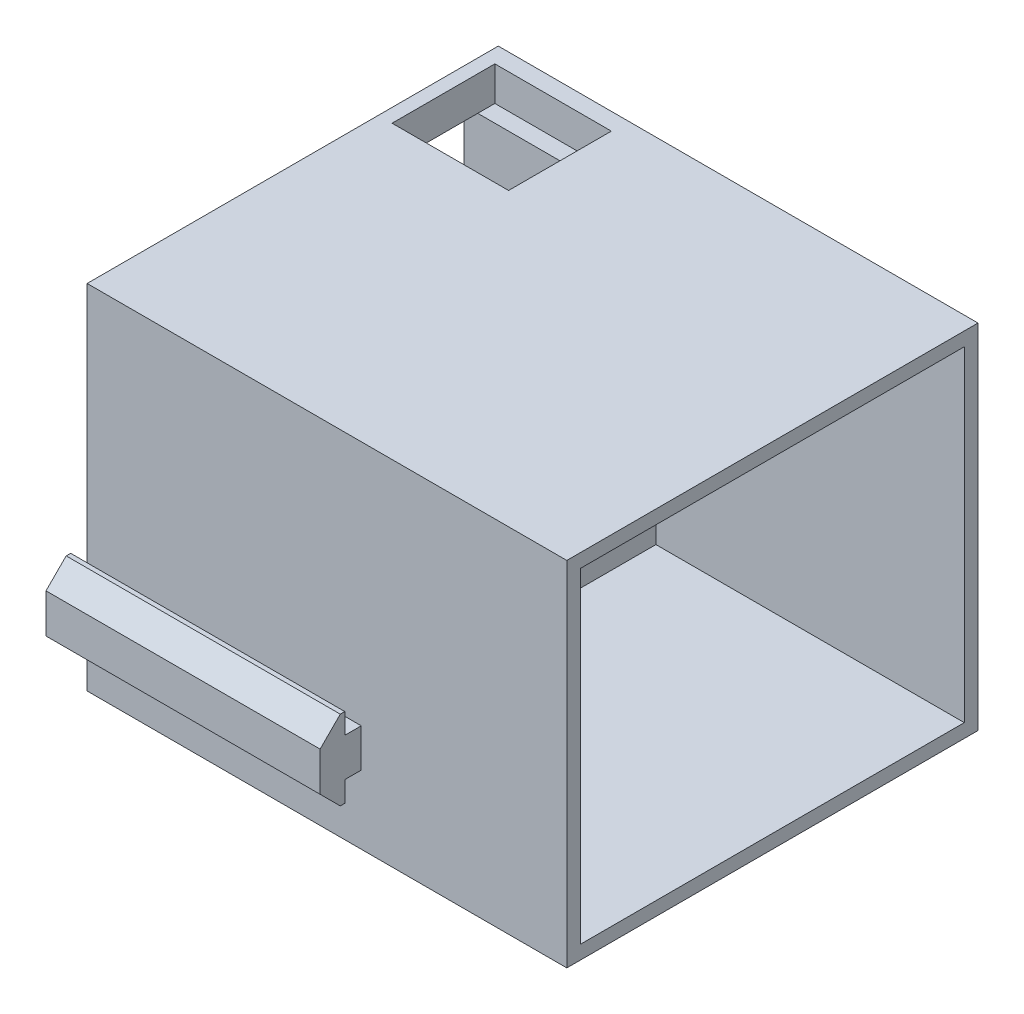
from build123d import *

# Parameters (mm, degrees)
SKETCH1_R            = 2.1
BOSS_EXTRUDE1_DEPTH  = 65
SKETCH84_W           = 0.2
SKETCH84_H           = 5.6
BOSS_EXTRUDE8_DEPTH  = 40
SKETCH86_W           = 21.745720746
SKETCH86_H           = 21.517119214
CUT_EXTRUDE59_DEPTH  = 67.55103305
SKETCH87_W           = 20
SKETCH87_H           = 51.5
SKETCH87_W_2         = 10
SKETCH87_H_2         = 41.5
BOSS_EXTRUDE9_DEPTH  = 70
SKETCH88_W           = 17
SKETCH88_H           = 15
CUT_EXTRUDE60_DEPTH  = 5
SKETCH89_W           = 20
SKETCH89_H           = 51.5
BOSS_EXTRUDE10_DEPTH = 50
SKETCH90_W           = 10
SKETCH90_H           = 41.5
BOSS_EXTRUDE11_DEPTH = 5
SKETCH91_W           = 16
SKETCH91_H           = 47.5
CUT_EXTRUDE61_DEPTH  = 30
SKETCH92_W           = 70
SKETCH92_H           = 51.5
BOSS_EXTRUDE12_DEPTH = 40
BOSS_EXTRUDE13_DEPTH = 40
SKETCH94_W           = 13.084115127
SKETCH94_H           = 30.286066168
CUT_EXTRUDE62_DEPTH  = 40
SKETCH95_W           = 56
SKETCH95_H           = 47.5
CUT_EXTRUDE63_DEPTH  = 45
SKETCH97_W           = 37
SKETCH97_H           = 45.5
CUT_EXTRUDE64_DEPTH  = 45
SKETCH98_W           = 38
SKETCH98_H           = 47.5
CUT_EXTRUDE65_DEPTH  = 45


with BuildPart() as part:
    # Sketch1 → Boss-Extrude1 (new body)
    with BuildSketch(Plane(origin=(0, 0, 0), x_dir=(0, 0, -1), z_dir=(1, 0, 0))):
        with BuildLine():
            Line((-10, 9), (-10, 3))
            Line((-10, 3), (-8, 3))
            Line((-8, 3), (-8, 6))
            Line((-8, 6), (-7.060660172, 6))
            Line((-7.060660172, 6), (-4, 2.939339828))
            Line((-4, 2.939339828), (-4, -2.939339828))
            Line((-4, -2.939339828), (-7.060660172, -6))
            Line((-7.060660172, -6), (-8, -6))
            Line((-8, -6), (-8, -3))
            Line((-8, -3), (-10, -3))
            Line((-10, -3), (-10, -9))
            ThreePointArc((-10, -9), (-9.707106781, -9.707106781), (-9, -10))
            Line((-9, -10), (-3, -10))
            Line((-3, -10), (-3, -8))
            Line((-3, -8), (-6, -8))
            Line((-6, -8), (-6, -7.060660172))
            Line((-6, -7.060660172), (-2.939339828, -4))
            Line((-2.939339828, -4), (2.939339828, -4))
            Line((2.939339828, -4), (6, -7.060660172))
            Line((6, -7.060660172), (6, -8))
            Line((6, -8), (3, -8))
            Line((3, -8), (3, -10))
            Line((3, -10), (9, -10))
            ThreePointArc((9, -10), (9.707106781, -9.707106781), (10, -9))
            Line((10, -9), (10, -3))
            Line((10, -3), (8, -3))
            Line((8, -3), (8, -6))
            Line((8, -6), (7.060660172, -6))
            Line((7.060660172, -6), (4, -2.939339828))
            Line((4, -2.939339828), (4, 2.939339828))
            Line((4, 2.939339828), (7.060660172, 6))
            Line((7.060660172, 6), (8, 6))
            Line((8, 6), (8, 3))
            Line((8, 3), (10, 3))
            Line((10, 3), (10, 9))
            ThreePointArc((10, 9), (9.707106781, 9.707106781), (9, 10))
            Line((9, 10), (3, 10))
            Line((3, 10), (3, 8))
            Line((3, 8), (6, 8))
            Line((6, 8), (6, 7.060660172))
            Line((6, 7.060660172), (2.939339828, 4))
            Line((2.939339828, 4), (-2.939339828, 4))
            Line((-2.939339828, 4), (-6, 7.060660172))
            Line((-6, 7.060660172), (-6, 8))
            Line((-6, 8), (-3, 8))
            Line((-3, 8), (-3, 10))
            Line((-3, 10), (-9, 10))
            ThreePointArc((-9, 10), (-9.707106781, 9.707106781), (-10, 9))
        make_face()
        Circle(SKETCH1_R, mode=Mode.SUBTRACT)
    extrude(amount=BOSS_EXTRUDE1_DEPTH)

    # Sketch86 → Cut-Extrude59 (cut, through all)
    with BuildSketch(Plane(origin=(65, 0, 0), x_dir=(0, 0, -1), z_dir=(1, 0, 0))):
        with Locations((0.085738745, -0.242889128)):
            Rectangle(SKETCH86_W, SKETCH86_H)
    extrude(amount=-CUT_EXTRUDE59_DEPTH, mode=Mode.SUBTRACT)


with BuildPart() as body_2:
    # Sketch84 → Boss-Extrude8 (new body)
    with BuildSketch(Plane(origin=(65, 0, 0), x_dir=(0, 0, -1), z_dir=(1, 0, 0))):
        with Locations((-10.1, 0)):
            Rectangle(SKETCH84_W, SKETCH84_H)
        with Locations((-9.9, 0)):
            Rectangle(SKETCH84_W, SKETCH84_H)
        Polygon((-7.8, 5.8), (-7.143502884, 5.8), (-4.2, 2.856497116), (-4.2, -2.856497116), (-7.143502884, -5.8), (-7.8, -5.8), (-7.8, -2.8), (-9.8, -2.8), (-9.8, 2.8), (-7.8, 2.8), align=None)
    extrude(amount=BOSS_EXTRUDE8_DEPTH)

    # Sketch87 → Boss-Extrude9 (add)
    with BuildSketch(Plane.ZY.offset(-65)):
        with Locations((20.2, 12.95)):
            Rectangle(SKETCH87_W, SKETCH87_H)
        with Locations((20.2, 12.95)):
            Rectangle(SKETCH87_W_2, SKETCH87_H_2, mode=Mode.SUBTRACT)
    extrude(amount=-BOSS_EXTRUDE9_DEPTH)

    # Sketch88 → Cut-Extrude60 (cut)
    with BuildSketch(Plane(origin=(0, 38.7, 0), x_dir=(1, 0, 0), z_dir=(0, 1, 0))):
        with Locations((75.5, -20.2)):
            Rectangle(SKETCH88_W, SKETCH88_H)
    extrude(amount=-CUT_EXTRUDE60_DEPTH, mode=Mode.SUBTRACT)

    # Sketch89 → Boss-Extrude10 (add)
    with BuildSketch(Plane(origin=(135, 0, 0), x_dir=(0, 0, -1), z_dir=(1, 0, 0))):
        with Locations((-20.2, 12.95)):
            Rectangle(SKETCH89_W, SKETCH89_H)
    extrude(amount=-BOSS_EXTRUDE10_DEPTH)

    # Sketch90 → Boss-Extrude11 (add)
    with BuildSketch(Plane.ZY.offset(-85)):
        with Locations((20.2, 12.95)):
            Rectangle(SKETCH90_W, SKETCH90_H)
    extrude(amount=BOSS_EXTRUDE11_DEPTH)

    # Sketch91 → Cut-Extrude61 (cut)
    with BuildSketch(Plane(origin=(135, 0, 0), x_dir=(0, 0, -1), z_dir=(1, 0, 0))):
        with Locations((-20.2, 12.95)):
            Rectangle(SKETCH91_W, SKETCH91_H)
    extrude(amount=-CUT_EXTRUDE61_DEPTH, mode=Mode.SUBTRACT)

    # Sketch92 → Boss-Extrude12 (add)
    with BuildSketch(Plane.XY.offset(30.2)):
        with Locations((100, 12.95)):
            Rectangle(SKETCH92_W, SKETCH92_H)
    extrude(amount=BOSS_EXTRUDE12_DEPTH)

    # Sketch93 → Boss-Extrude13 (add)
    with BuildSketch(Plane.ZY.offset(-65)):
        Polygon((72.6, 2.8), (70.2, 2.8), (70.2, -2.8), (72.6, -2.8), (72.6, -5.8), (73.256497116, -5.8), (76.2, -2.856497116), (76.2, 2.856497116), (73.256497116, 5.8), (72.6, 5.8), align=None)
    extrude(amount=-BOSS_EXTRUDE13_DEPTH)

    # Sketch94 → Cut-Extrude62 (cut)
    with BuildSketch(Plane.ZY.offset(-65)):
        with Locations((3.657942437, 5.120137749)):
            Rectangle(SKETCH94_W, SKETCH94_H)
    extrude(amount=-CUT_EXTRUDE62_DEPTH, mode=Mode.SUBTRACT)

    # Sketch95 → Cut-Extrude63 (cut)
    with BuildSketch(Plane(origin=(135, 0, 0), x_dir=(0, 0, -1), z_dir=(1, 0, 0))):
        with Locations((-40.2, 12.95)):
            Rectangle(SKETCH95_W, SKETCH95_H)
    extrude(amount=-CUT_EXTRUDE63_DEPTH, mode=Mode.SUBTRACT)

    # Sketch97 → Cut-Extrude64 (cut)
    with BuildSketch(Plane.ZY.offset(-65)):
        with Locations((48.7, 12.95)):
            Rectangle(SKETCH97_W, SKETCH97_H)
    extrude(amount=-CUT_EXTRUDE64_DEPTH, mode=Mode.SUBTRACT)

    # Sketch98 → Cut-Extrude65 (cut)
    with BuildSketch(Plane(origin=(90, 0, 0), x_dir=(0, 0, -1), z_dir=(1, 0, 0))):
        with Locations((-49.2, 12.95)):
            Rectangle(SKETCH98_W, SKETCH98_H)
    extrude(amount=-CUT_EXTRUDE65_DEPTH, mode=Mode.SUBTRACT)


solid = body_2.part
